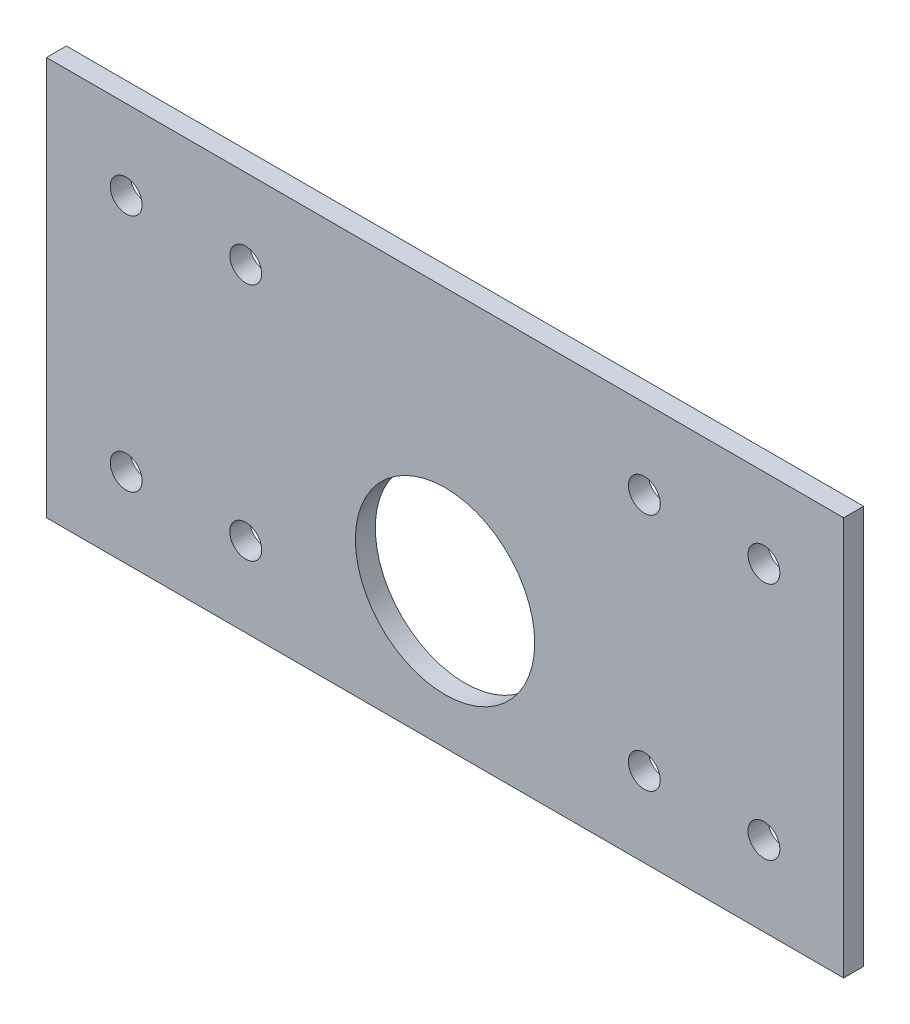
from build123d import *

# Parameters (mm, degrees)
SKETCH1_W               = 127
SKETCH1_H               = 63.5
BOSS_EXTRUDE1_DEPTH     = 1.5875
CUT_EXTRUDE2_DEPTH      = 72.066117982
CUT_EXTRUDE2_DEPTH_BACK = 72.066117982
SKETCH3_R               = 14.2875
CUT_EXTRUDE3_DEPTH      = 72.012904857
CUT_EXTRUDE3_DEPTH_BACK = 72.012904857
SKETCH4_R               = 2.54
CUT_EXTRUDE4_DEPTH      = 72.012904857
CUT_EXTRUDE4_DEPTH_BACK = 72.012904857
SKETCH5_R               = 2.54


with BuildPart() as part:
    # Sketch1 → Boss-Extrude1 (new, symmetric)
    with BuildSketch(Plane.XY):
        Rectangle(SKETCH1_W, SKETCH1_H)
    extrude(amount=BOSS_EXTRUDE1_DEPTH, both=True)

    # Sketch3 → Cut-Extrude2 (cut, two sides: drawn at the far end of the back side and taken through both)
    with BuildSketch(Plane.XY.offset(1.5875).offset(-CUT_EXTRUDE2_DEPTH_BACK)):
        with Locations((0, -10.125)):
            Circle(SKETCH3_R)
    extrude(amount=CUT_EXTRUDE2_DEPTH + CUT_EXTRUDE2_DEPTH_BACK, mode=Mode.SUBTRACT)

    # Sketch4 → Cut-Extrude3 (cut, two sides: drawn at the far end of the back side and taken through both)
    with BuildSketch(Plane.XY.offset(-CUT_EXTRUDE3_DEPTH_BACK)):
        with Locations((-50.8, 19.05)):
            Circle(SKETCH4_R)
        with Locations((-50.8, -19.05)):
            Circle(SKETCH4_R)
        with Locations((50.8, -19.05)):
            Circle(SKETCH4_R)
        with Locations((50.8, 19.05)):
            Circle(SKETCH4_R)
    extrude(amount=CUT_EXTRUDE3_DEPTH + CUT_EXTRUDE3_DEPTH_BACK, mode=Mode.SUBTRACT)

    # Sketch5 → Cut-Extrude4 (cut, two sides: drawn at the far end of the back side and taken through both)
    with BuildSketch(Plane.XY.offset(-CUT_EXTRUDE4_DEPTH_BACK)):
        with Locations((31.75, 19.05)):
            Circle(SKETCH5_R)
        with Locations((-31.75, 19.05)):
            Circle(SKETCH5_R)
        with Locations((-31.75, -19.05)):
            Circle(SKETCH5_R)
        with Locations((31.75, -19.05)):
            Circle(SKETCH5_R)
    extrude(amount=CUT_EXTRUDE4_DEPTH + CUT_EXTRUDE4_DEPTH_BACK, mode=Mode.SUBTRACT)


solid = part.part
